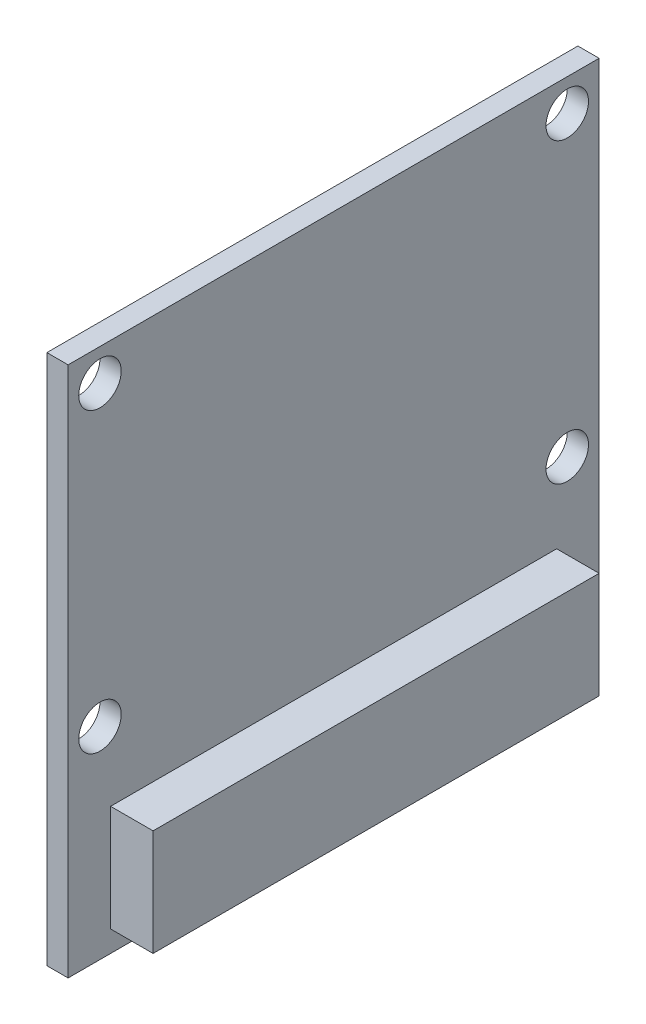
from build123d import *

# Parameters (mm, degrees)
SKETCH1_W           = 25
SKETCH1_H           = 25
BOSS_EXTRUDE1_DEPTH = 1
SKETCH2_W           = 21
SKETCH2_H           = 5
BOSS_EXTRUDE2_DEPTH = 2
SKETCH3_W           = 8
SKETCH3_H           = 8
BOSS_EXTRUDE3_DEPTH = 2
SKETCH5_R           = 3.5
BOSS_EXTRUDE4_DEPTH = 1
BOSS_EXTRUDE5_DEPTH = 1
SKETCH7_R           = 1
CUT_EXTRUDE1_DEPTH  = 1


with BuildPart() as part:
    # Sketch1 → Boss-Extrude1 (new body)
    with BuildSketch(Plane(origin=(0, 0, 0), x_dir=(0, 0, -1), z_dir=(1, 0, 0))):
        with Locations((12.5, 12.5)):
            Rectangle(SKETCH1_W, SKETCH1_H)
    extrude(amount=BOSS_EXTRUDE1_DEPTH)

    # Sketch2 → Boss-Extrude2 (add)
    with BuildSketch(Plane(origin=(1, 0, 0), x_dir=(0, 0, -1), z_dir=(1, 0, 0))):
        with Locations((12.5, 3.5)):
            Rectangle(SKETCH2_W, SKETCH2_H)
    extrude(amount=BOSS_EXTRUDE2_DEPTH)

    # Sketch3 → Boss-Extrude3 (add)
    with BuildSketch(Plane.ZY):
        with Locations((-12.5, 10)):
            Rectangle(SKETCH3_W, SKETCH3_H)
    extrude(amount=BOSS_EXTRUDE3_DEPTH)

    # Sketch5 → Boss-Extrude4 (add)
    with BuildSketch(Plane.ZY.offset(2)):
        with Locations((-12.5, 10)):
            Circle(SKETCH5_R)
    extrude(amount=BOSS_EXTRUDE4_DEPTH)

    # Sketch6 → Boss-Extrude5 (add)
    with BuildSketch(Plane.ZY):
        Polygon((-16, 23.363866642), (-9, 23.363866642), (-9, 19.363866642), (-10, 19.363866642), (-10, 14), (-15, 14), (-15, 19.363866642), (-16, 19.363866642), align=None)
    extrude(amount=BOSS_EXTRUDE5_DEPTH)

    # Sketch7 → Cut-Extrude1 (cut)
    with BuildSketch(Plane.ZY):
        with Locations((-23.5, 23.5)):
            Circle(SKETCH7_R)
        with Locations((-1.5, 23.5)):
            Circle(SKETCH7_R)
        with Locations((-1.5, 9.5)):
            Circle(SKETCH7_R)
        with Locations((-23.5, 9.5)):
            Circle(SKETCH7_R)
    extrude(amount=-CUT_EXTRUDE1_DEPTH, mode=Mode.SUBTRACT)


solid = part.part
